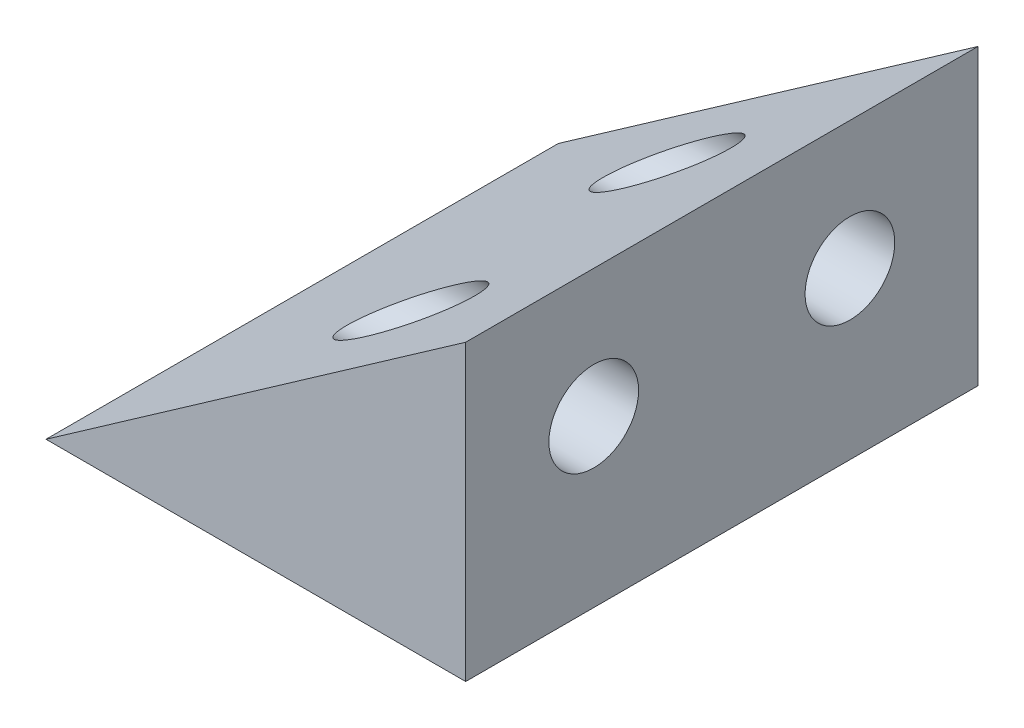
from build123d import *

# Parameters (mm, degrees)
BOSS_EXTRUDE1_DEPTH = 20
CUT_EXTRUDE1_REACH  = 30.284
SKETCH3_R           = 1.75
CUT_EXTRUDE2_DEPTH  = 1


with BuildPart() as part:
    # Sketch1 → Boss-Extrude1 (new body)
    with BuildSketch(Plane.XY):
        Polygon((0, 0), (-16.383040886, 0), (0, 11.471528727), align=None)
    extrude(amount=BOSS_EXTRUDE1_DEPTH)

    # Cut-Extrude1: up to this plane
    cut_extrude1_end = Plane(origin=(-16.383040886, 0, 20), z_dir=(0.5735764363510414, -0.8191520442889951, 0))
    # Sketch3 → Cut-Extrude1 (cut, up to the surface)
    with BuildSketch(Plane(origin=(0, 0, 0), x_dir=(0, 0, -1), z_dir=(1, 0, 0)), mode=Mode.PRIVATE) as cut_extrude1_sk1:
        with Locations(Location((-5, 6.471528727, 0), (0, 0, 90))):
            Circle(SKETCH3_R)
    cut_extrude1_tool1 = split(extrude(cut_extrude1_sk1.sketch, amount=-CUT_EXTRUDE1_REACH, mode=Mode.PRIVATE), bisect_by=cut_extrude1_end, keep=Keep.BOTH, mode=Mode.PRIVATE)
    add(cut_extrude1_tool1.solids().sort_by_distance((0, 6.471529, 5))[0], mode=Mode.SUBTRACT)
    # Sketch3 → Cut-Extrude1 (cut, up to the surface)
    with BuildSketch(Plane(origin=(0, 0, 0), x_dir=(0, 0, -1), z_dir=(1, 0, 0)), mode=Mode.PRIVATE) as cut_extrude1_sk2:
        with Locations(Location((-15, 6.471528727, 0), (0, 0, 90))):
            Circle(SKETCH3_R)
    cut_extrude1_tool2 = split(extrude(cut_extrude1_sk2.sketch, amount=-CUT_EXTRUDE1_REACH, mode=Mode.PRIVATE), bisect_by=cut_extrude1_end, keep=Keep.BOTH, mode=Mode.PRIVATE)
    add(cut_extrude1_tool2.solids().sort_by_distance((0, 6.471529, 15))[0], mode=Mode.SUBTRACT)

    # Sketch4 → Cut-Extrude2 (cut)
    with BuildSketch(Plane.XZ):
        with BuildLine():
            Line((-4.691520443, 7.666666667), (-5.050494802, 7.666666667))
            Line((-5.050494802, 7.666666667), (-5.050494802, 8.857171474))
            Line((-5.050494802, 8.857171474), (-5.971067719, 9.045773237))
            add(Edge.make_bspline(
                [(-5.971067719, 9.045773237), (-5.960837447, 9.008717363), (-5.941017913, 8.936927467), (-5.919012143, 8.830967606), (-5.905746699, 8.730375403), (-5.903935388, 8.665100032), (-5.903058904, 8.633513622)],
                knots=[0, 0, 0, 0, 1.100273476, 2.13160584, 3.095893838, 4, 4, 4, 4], degree=3))
            add(Edge.make_bspline(
                [(-5.903058904, 8.633513622), (-5.903905062, 8.594430017), (-5.905568818, 8.517581885), (-5.921537521, 8.405141021), (-5.946688861, 8.297815088), (-5.981767913, 8.195787456), (-6.026914183, 8.098838369), (-6.082578591, 8.007509235), (-6.148376109, 7.921282459), (-6.223671904, 7.841297924), (-6.306642868, 7.768848501), (-6.395561822, 7.70489717), (-6.490509646, 7.651710301), (-6.591066489, 7.607952665), (-6.697063628, 7.573235207), (-6.809285651, 7.550064621), (-6.926736691, 7.534653053), (-7.007040855, 7.532929952), (-7.047990795, 7.532051282)],
                knots=[0, 0, 0, 0, 1.052772836, 2.070014431, 3.053871312, 4.019926262, 4.972333346, 5.930471369, 6.896690565, 7.89035727, 8.885779078, 9.861050232, 10.836829716, 11.812751485, 12.812646763, 13.836748493, 14.896881366, 16, 16, 16, 16], degree=3))
            add(Edge.make_bspline(
                [(-7.047990795, 7.532051282), (-7.076513053, 7.532716268), (-7.133172115, 7.534037252), (-7.217315767, 7.540757153), (-7.299680641, 7.553687984), (-7.380265502, 7.571073738), (-7.458962617, 7.593549733), (-7.535743358, 7.621054036), (-7.610844148, 7.653474829), (-7.684269905, 7.690078673), (-7.753757031, 7.732422536), (-7.820378162, 7.777026854), (-7.881681502, 7.826436162), (-7.939905031, 7.878258305), (-7.992762219, 7.934565438), (-8.042515055, 7.993609877), (-8.087002377, 8.056777249), (-8.127920671, 8.122936622), (-8.164557321, 8.192046277), (-8.195118832, 8.264806972), (-8.22190626, 8.339621419), (-8.243689938, 8.417156432), (-8.260590924, 8.497261802), (-8.272100266, 8.580213377), (-8.280474314, 8.665594922), (-8.280998998, 8.723469815), (-8.281264033, 8.752704327)],
                knots=[0, 0, 0, 0, 1.05623316, 2.098192244, 3.122504159, 4.140841222, 5.148757784, 6.150489607, 7.158294732, 8.176043417, 9.185147859, 10.169157858, 11.142149047, 12.097904048, 13.0527185, 13.998867679, 14.954465986, 15.910220987, 16.877849176, 17.847023716, 18.829548819, 19.818454515, 20.826519638, 21.858115382, 22.918063636, 24, 24, 24, 24], degree=3))
            add(Edge.make_bspline(
                [(-8.281264033, 8.752704327), (-8.280573134, 8.787578465), (-8.279213873, 8.856189212), (-8.26499625, 8.956710387), (-8.244629183, 9.053422771), (-8.214004393, 9.145560969), (-8.175574738, 9.233902353), (-8.127313809, 9.317270931), (-8.071859805, 9.397305351), (-8.007299376, 9.471830371), (-7.936072419, 9.540858235), (-7.85960597, 9.603598567), (-7.777595985, 9.658621463), (-7.690740644, 9.706151467), (-7.5988905, 9.746635313), (-7.501770702, 9.778454211), (-7.399869821, 9.804131495), (-7.329716431, 9.814995063), (-7.294084545, 9.820512821)],
                knots=[0, 0, 0, 0, 1.046825758, 2.059506013, 3.044032586, 4.011925612, 4.970610144, 5.93275819, 6.900651216, 7.891265644, 8.889116719, 9.876966323, 10.858259055, 11.851035124, 12.847502422, 13.86866322, 14.9174643, 16, 16, 16, 16], degree=3))
            Line((-7.294084545, 9.820512821), (-7.294084545, 9.506410256))
            add(Edge.make_bspline(
                [(-7.294084545, 9.506410256), (-7.327464182, 9.498686563), (-7.391621698, 9.483841196), (-7.481710662, 9.451170718), (-7.562294351, 9.411471291), (-7.633448843, 9.363190442), (-7.695823334, 9.306761846), (-7.751887818, 9.242833095), (-7.801797057, 9.170493441), (-7.843666633, 9.090138997), (-7.879322545, 9.005315277), (-7.903077658, 8.916550899), (-7.919777658, 8.826245813), (-7.921449539, 8.765167542), (-7.922289674, 8.73447516)],
                knots=[0, 0, 0, 0, 1.136389429, 2.184203582, 3.172920998, 4.111012962, 5.028380909, 5.957351669, 6.927793475, 7.937618031, 8.960409703, 9.974842029, 10.982339866, 12, 12, 12, 12], degree=3))
            add(Edge.make_bspline(
                [(-7.922289674, 8.73447516), (-7.921468896, 8.704516716), (-7.919852777, 8.645528294), (-7.907413765, 8.558716907), (-7.888256194, 8.474904033), (-7.859586339, 8.394916676), (-7.824741621, 8.317355136), (-7.780026545, 8.244181366), (-7.728566526, 8.173278489), (-7.669609896, 8.106850355), (-7.604640202, 8.046010906), (-7.535162808, 7.992254785), (-7.461045962, 7.947477872), (-7.383572809, 7.909743763), (-7.301894252, 7.881090464), (-7.216393076, 7.860649483), (-7.126858096, 7.848646424), (-7.065788786, 7.846995244), (-7.034669481, 7.846153846)],
                knots=[0, 0, 0, 0, 1.027316725, 2.022795036, 3.002884548, 3.971462791, 4.93288096, 5.914575861, 6.907176829, 7.935150275, 8.956128384, 9.956726525, 10.942570165, 11.921478529, 12.907843606, 13.90538589, 14.932640048, 16, 16, 16, 16], degree=3))
            add(Edge.make_bspline(
                [(-7.034669481, 7.846153846), (-7.006576813, 7.846706266), (-6.951557898, 7.847788169), (-6.87141873, 7.859810767), (-6.795041436, 7.876652561), (-6.723109034, 7.902510988), (-6.654568178, 7.934461268), (-6.590885891, 7.974996353), (-6.530426067, 8.02133213), (-6.475644859, 8.075604142), (-6.424743099, 8.134785463), (-6.381414351, 8.200249894), (-6.344946295, 8.270504239), (-6.31347944, 8.34473538), (-6.290878376, 8.424699848), (-6.27391058, 8.508816602), (-6.264095192, 8.597993276), (-6.262733308, 8.658963969), (-6.262033263, 8.690304487)],
                knots=[0, 0, 0, 0, 1.045726679, 2.048034203, 3.01323695, 3.95502507, 4.889743367, 5.8246644, 6.761650845, 7.722168973, 8.692072792, 9.66525385, 10.638902184, 11.638179751, 12.663148338, 13.728659964, 14.832472288, 16, 16, 16, 16], degree=3))
            add(Edge.make_bspline(
                [(-6.262033263, 8.690304487), (-6.262594139, 8.71766901), (-6.263742339, 8.773688437), (-6.272778432, 8.859818209), (-6.286679592, 8.94993381), (-6.3067156, 9.044385095), (-6.331802062, 9.142912859), (-6.363131907, 9.245680957), (-6.399219938, 9.35269187), (-6.427211044, 9.424717877), (-6.441520443, 9.461538462)],
                knots=[0, 0, 0, 0, 0.824638674, 1.688163388, 2.607705698, 3.571998603, 4.597075385, 5.671199175, 6.809488238, 8, 8, 8, 8], degree=3))
            Line((-6.441520443, 9.461538462), (-4.691520443, 9.102564103))
            Line((-4.691520443, 9.102564103), (-4.691520443, 7.666666667))
        make_face()
        with BuildLine():
            Line((-5.499212751, 12.108974359), (-5.499212751, 12.423076923))
            add(Edge.make_bspline(
                [(-5.499212751, 12.423076923), (-5.463980267, 12.414567372), (-5.395103642, 12.397931897), (-5.296696381, 12.363234323), (-5.20357286, 12.325435068), (-5.117476786, 12.280045964), (-5.036677884, 12.230537209), (-4.963008759, 12.173814488), (-4.894595794, 12.112494765), (-4.833882556, 12.044669816), (-4.778904827, 11.973541154), (-4.73202977, 11.898106535), (-4.691705617, 11.819883641), (-4.658485385, 11.738330508), (-4.633459861, 11.653204336), (-4.615303056, 11.565274713), (-4.603511941, 11.474311213), (-4.602361178, 11.412563622), (-4.601776853, 11.381209936)],
                knots=[0, 0, 0, 0, 1.162005537, 2.271625781, 3.343758855, 4.383309926, 5.390229558, 6.379919256, 7.361854164, 8.333198761, 9.295911338, 10.242430842, 11.177959212, 12.116337295, 13.062827104, 14.020064771, 14.994644689, 16, 16, 16, 16], degree=3))
            add(Edge.make_bspline(
                [(-4.601776853, 11.381209936), (-4.603156083, 11.335527194), (-4.605884459, 11.245158183), (-4.630798895, 11.112395136), (-4.670224028, 10.984368317), (-4.724697755, 10.862479069), (-4.791885068, 10.749260636), (-4.871849805, 10.64852445), (-4.963049106, 10.561635939), (-5.063781671, 10.488741561), (-5.17143718, 10.431666562), (-5.282237337, 10.389580189), (-5.395919309, 10.363958508), (-5.472676588, 10.360637951), (-5.511131821, 10.358974359)],
                knots=[0, 0, 0, 0, 1.083050992, 2.142477498, 3.193116406, 4.255571735, 5.30263384, 6.308962982, 7.297363603, 8.282367274, 9.249857812, 10.179914175, 11.08814088, 12, 12, 12, 12], degree=3))
            add(Edge.make_bspline(
                [(-5.511131821, 10.358974359), (-5.548138616, 10.36013795), (-5.62055517, 10.362414917), (-5.726276667, 10.381748623), (-5.825918268, 10.414284886), (-5.91989943, 10.459354648), (-6.00762427, 10.517696198), (-6.08929016, 10.588368895), (-6.165259319, 10.671871557), (-6.208778792, 10.735150495), (-6.231183904, 10.767728365)],
                knots=[0, 0, 0, 0, 1.024540389, 2.004866551, 2.965041327, 3.920577974, 4.882998113, 5.874504559, 6.905732034, 8, 8, 8, 8], degree=3))
            add(Edge.make_bspline(
                [(-6.231183904, 10.767728365), (-6.249162076, 10.730496611), (-6.284782034, 10.656729737), (-6.354637791, 10.556179207), (-6.435294138, 10.464901332), (-6.498236791, 10.413997613), (-6.529861789, 10.388421474)],
                knots=[0, 0, 0, 0, 1.015518401, 2.012035669, 3.001164323, 4, 4, 4, 4], degree=3))
            add(Edge.make_bspline(
                [(-6.529861789, 10.388421474), (-6.552917083, 10.371573277), (-6.598650126, 10.338152782), (-6.672222451, 10.297017402), (-6.746366682, 10.259272918), (-6.823998076, 10.23149407), (-6.902622973, 10.207522025), (-6.983925048, 10.191749218), (-7.067131862, 10.181623707), (-7.123448567, 10.180201878), (-7.151756821, 10.179487179)],
                knots=[0, 0, 0, 0, 1.02516404, 2.033540309, 3.025129118, 4.011046665, 4.991655828, 5.976607087, 6.982917762, 8, 8, 8, 8], degree=3))
            add(Edge.make_bspline(
                [(-7.151756821, 10.179487179), (-7.200764593, 10.181285644), (-7.298549507, 10.184874111), (-7.443053461, 10.216818914), (-7.5840642, 10.266627657), (-7.719492404, 10.336123526), (-7.845938982, 10.422108171), (-7.958561011, 10.524971177), (-8.056019926, 10.642211961), (-8.137186574, 10.773063205), (-8.20211639, 10.914767889), (-8.247170597, 11.066346867), (-8.276517478, 11.225595999), (-8.279664225, 11.334803424), (-8.281264033, 11.390324519)],
                knots=[0, 0, 0, 0, 0.95570045, 1.906903359, 2.87519758, 3.868912786, 4.869932978, 5.851730567, 6.836639976, 7.83677598, 8.849487602, 9.869908895, 10.917060885, 12, 12, 12, 12], degree=3))
            add(Edge.make_bspline(
                [(-8.281264033, 11.390324519), (-8.280395819, 11.42774382), (-8.278687465, 11.501372525), (-8.267008864, 11.609616023), (-8.245678859, 11.712937722), (-8.216975553, 11.81147732), (-8.180583811, 11.905322357), (-8.135265113, 11.994186462), (-8.081953611, 12.078616355), (-8.020020023, 12.157815306), (-7.950738684, 12.231773874), (-7.872879674, 12.298526598), (-7.78788227, 12.359186391), (-7.694759214, 12.41212903), (-7.594713956, 12.459765983), (-7.486465458, 12.498946939), (-7.370981436, 12.533432508), (-7.290503696, 12.549465972), (-7.249212751, 12.557692308)],
                knots=[0, 0, 0, 0, 1.048658725, 2.063410685, 3.046034179, 4.001477787, 4.936774919, 5.862367409, 6.792675028, 7.730719943, 8.675894397, 9.627829632, 10.600096036, 11.597688215, 12.626045268, 13.701542398, 14.82072376, 16, 16, 16, 16], degree=3))
            Line((-7.249212751, 12.557692308), (-7.249212751, 12.243589744))
            add(Edge.make_bspline(
                [(-7.249212751, 12.243589744), (-7.276161764, 12.235406452), (-7.328579935, 12.219489239), (-7.404020241, 12.192394941), (-7.473178294, 12.161526669), (-7.536561416, 12.128412111), (-7.594793819, 12.093633665), (-7.646335688, 12.05471874), (-7.69345089, 12.014549594), (-7.719995502, 11.984270241), (-7.732986789, 11.969451122)],
                knots=[0, 0, 0, 0, 1.198163088, 2.33053128, 3.407730985, 4.417276592, 5.372219308, 6.28897303, 7.162600585, 8, 8, 8, 8], degree=3))
            add(Edge.make_bspline(
                [(-7.732986789, 11.969451122), (-7.748095123, 11.949854545), (-7.778265155, 11.910721882), (-7.816766783, 11.846953651), (-7.850127809, 11.779888765), (-7.875611504, 11.708074091), (-7.897189165, 11.633059321), (-7.911309684, 11.553631955), (-7.920997856, 11.470492738), (-7.921852787, 11.413724975), (-7.922289674, 11.384715545)],
                knots=[0, 0, 0, 0, 0.946170439, 1.889420265, 2.845303464, 3.807233317, 4.801018734, 5.828864929, 6.890507805, 8, 8, 8, 8], degree=3))
            add(Edge.make_bspline(
                [(-7.922289674, 11.384715545), (-7.92167477, 11.351961599), (-7.920472379, 11.287914085), (-7.909382678, 11.19446542), (-7.893302266, 11.10553584), (-7.868149375, 11.022032871), (-7.837974328, 10.942820243), (-7.798469652, 10.86966621), (-7.753855507, 10.800420135), (-7.701960677, 10.737110607), (-7.645867982, 10.680033971), (-7.586358632, 10.630713452), (-7.525277803, 10.587996242), (-7.461200604, 10.553658734), (-7.39475558, 10.526496153), (-7.325694026, 10.508016164), (-7.254597485, 10.495163794), (-7.206268418, 10.494117297), (-7.181905058, 10.493589744)],
                knots=[0, 0, 0, 0, 1.216990249, 2.379719373, 3.493992396, 4.571561497, 5.616923107, 6.638958652, 7.655775068, 8.674704564, 9.676001865, 10.625896028, 11.54399481, 12.441854662, 13.322657739, 14.20572845, 15.095482574, 16, 16, 16, 16], degree=3))
            add(Edge.make_bspline(
                [(-7.181905058, 10.493589744), (-7.149293683, 10.495120018), (-7.084233201, 10.498172952), (-6.988516179, 10.521481939), (-6.896290613, 10.559819215), (-6.809143259, 10.613497946), (-6.7283351, 10.678809892), (-6.656516456, 10.755122835), (-6.596659757, 10.842623973), (-6.555456651, 10.923676649), (-6.527996513, 10.995643653), (-6.508741978, 11.057109192), (-6.493350245, 11.125982608), (-6.478461803, 11.201437091), (-6.465980278, 11.283790868), (-6.455526512, 11.373118137), (-6.447174997, 11.469454834), (-6.443443396, 11.536145866), (-6.441520443, 11.570512821)],
                knots=[0, 0, 0, 0, 1.070481957, 2.135637345, 3.216366529, 4.339485895, 5.485746587, 6.620975969, 7.768829582, 8.956804399, 9.598399438, 10.297751078, 11.070570279, 11.915248466, 12.824061284, 13.805856426, 14.869322739, 16, 16, 16, 16], degree=3))
            Line((-6.441520443, 11.570512821), (-6.082546084, 11.570512821))
            add(Edge.make_bspline(
                [(-6.082546084, 11.570512821), (-6.081808076, 11.527212852), (-6.080362501, 11.442398849), (-6.062999591, 11.318487697), (-6.038711164, 11.199857415), (-6.002366763, 11.089215872), (-5.958743109, 10.988698863), (-5.909554254, 10.901013514), (-5.853825487, 10.828237933), (-5.792288197, 10.770190297), (-5.725518022, 10.727585393), (-5.656654524, 10.695606193), (-5.58409548, 10.67685869), (-5.534605496, 10.674341951), (-5.509729578, 10.673076923)],
                knots=[0, 0, 0, 0, 1.321708579, 2.588902423, 3.815526512, 5.016621128, 6.138757764, 7.158873101, 8.079948563, 8.928590313, 9.728601868, 10.489025425, 11.240515403, 12, 12, 12, 12], degree=3))
            add(Edge.make_bspline(
                [(-5.509729578, 10.673076923), (-5.491451788, 10.673491286), (-5.455088994, 10.674315641), (-5.40196457, 10.684713626), (-5.350461217, 10.700335025), (-5.300812627, 10.721824878), (-5.253306984, 10.750536242), (-5.207886006, 10.784999443), (-5.163788486, 10.825231116), (-5.123124103, 10.872282713), (-5.084767177, 10.923221086), (-5.051609041, 10.978525531), (-5.023504227, 11.036976242), (-5.00028366, 11.098626969), (-4.982827418, 11.163724682), (-4.970290723, 11.231950629), (-4.962453306, 11.303438482), (-4.961324857, 11.352210191), (-4.960751212, 11.377003205)],
                knots=[0, 0, 0, 0, 0.884317272, 1.759307272, 2.611736065, 3.488921043, 4.37244062, 5.294096728, 6.247679003, 7.258495569, 8.302441962, 9.333537773, 10.376747089, 11.440883505, 12.520330301, 13.637364711, 14.798958396, 16, 16, 16, 16], degree=3))
            add(Edge.make_bspline(
                [(-4.960751212, 11.377003205), (-4.962139875, 11.41685619), (-4.964852257, 11.494698339), (-4.988692873, 11.606894907), (-5.026465872, 11.711089135), (-5.072076656, 11.790464118), (-5.116945448, 11.849176863), (-5.15554607, 11.891936834), (-5.199311269, 11.933161827), (-5.249441475, 11.971234134), (-5.304212914, 12.00843513), (-5.363927246, 12.044409601), (-5.429435819, 12.078002045), (-5.475503335, 12.098450316), (-5.499212751, 12.108974359)],
                knots=[0, 0, 0, 0, 1.4727372, 2.876598283, 4.222346151, 5.558423782, 6.24313385, 6.953189256, 7.68715613, 8.463578749, 9.278833271, 10.135787152, 11.040551781, 12, 12, 12, 12], degree=3))
        make_face()
    extrude(amount=-CUT_EXTRUDE2_DEPTH, mode=Mode.SUBTRACT)


solid = part.part
